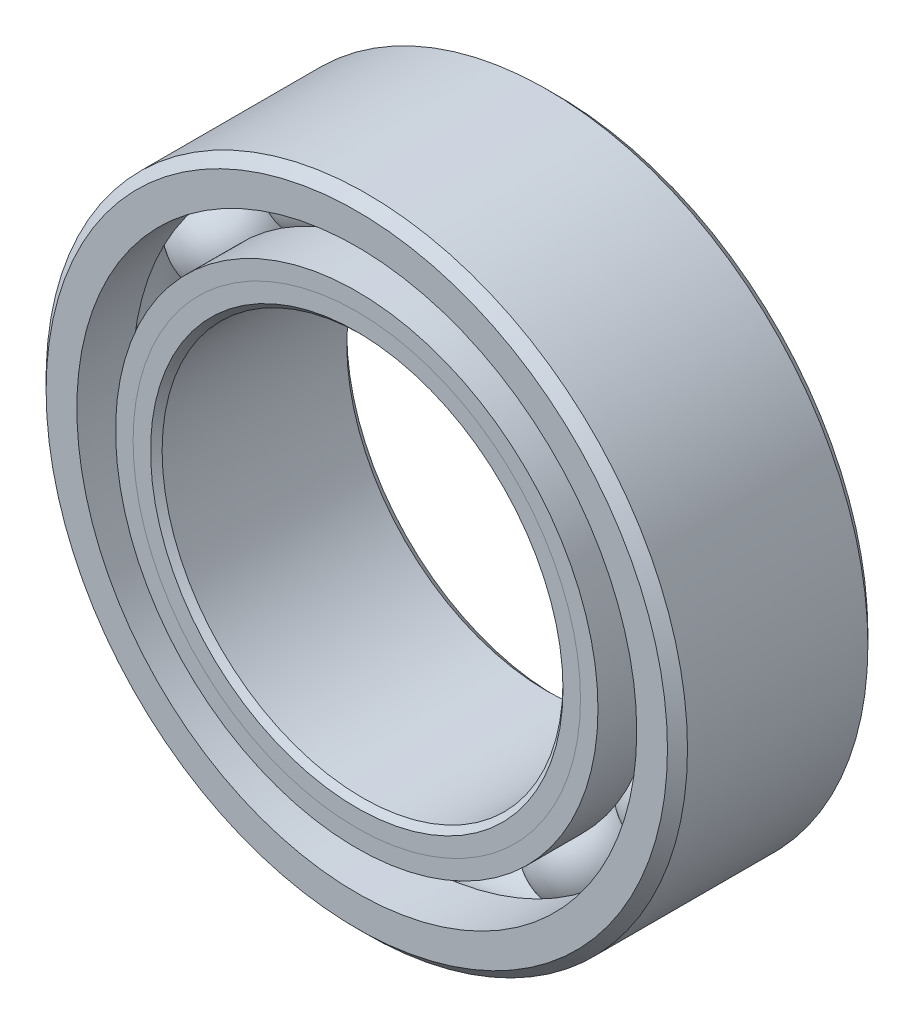
from build123d import *

# Parameters (mm, degrees)
CIRPATTERN1_COUNT = 12


with BuildPart() as part:
    # Sketch1 → Revolve1 (revolve)
    with BuildSketch(Plane(origin=(0, 0, 0), x_dir=(0, 0, -1), z_dir=(1, 0, 0)), mode=Mode.PRIVATE) as revolve1_sk:
        with BuildLine():
            Line((1.7859375, 6.35), (-1.7859375, 6.35))
            Line((-1.7859375, 6.35), (-1.984375, 6.1515625))
            Line((-1.984375, 6.1515625), (-1.984375, 5.543166209))
            Line((-1.984375, 5.543166209), (-0.881944444, 5.543166209))
            ThreePointArc((-0.881944444, 5.543166209), (0, 6.121207467), (0.881944444, 5.543166209))
            Line((0.881944444, 5.543166209), (1.984375, 5.543166209))
            Line((1.984375, 5.543166209), (1.984375, 6.1515625))
            Line((1.984375, 6.1515625), (1.7859375, 6.35))
        make_face()
    revolve(revolve1_sk.sketch.rotate(Axis((0, 0, 1.984375), (0, 0, -1)), 90), axis=Axis((0, 0, 1.984375), (0, 0, -1)))


with BuildPart() as body_2:
    # Sketch2 → Revolve2 (revolve)
    with BuildSketch(Plane(origin=(0, 0, 0), x_dir=(0, 0, -1), z_dir=(1, 0, 0)), mode=Mode.PRIVATE) as revolve2_sk:
        with BuildLine():
            Line((-1.984375, 4.775583791), (-0.881944444, 4.775583791))
            ThreePointArc((-0.881944444, 4.775583791), (-0.527247025, 4.354929682), (0, 4.197542533))
            Line((0, 4.197542533), (0, 4.083146266))
            Line((0, 4.083146266), (-1.638156238, 4.083146266))
            Line((-1.638156238, 4.083146266), (-1.984375, 4.429365029))
            Line((-1.984375, 4.429365029), (-1.984375, 4.775583791))
        make_face()
    revolve(revolve2_sk.sketch.rotate(Axis((0, 0, 1.984375), (0, 0, -1)), 90), axis=Axis((0, 0, 1.984375), (0, 0, -1)))


with BuildPart() as body_3:
    # Sketch3 → Revolve3 (revolve)
    with BuildSketch(Plane(origin=(0, 0, 0), x_dir=(0, 0, -1), z_dir=(1, 0, 0)), mode=Mode.PRIVATE) as revolve3_sk:
        with BuildLine():
            Line((-1.984375, 4.429365029), (-1.638156238, 4.083146266))
            Line((-1.638156238, 4.083146266), (0, 4.083146266))
            Line((0, 4.083146266), (0, 4.197542533))
            ThreePointArc((0, 4.197542533), (0.527247025, 4.354929682), (0.881944444, 4.775583791))
            Line((0.881944444, 4.775583791), (1.984375, 4.775583791))
            Line((1.984375, 4.775583791), (1.984375, 4.1671875))
            Line((1.984375, 4.1671875), (1.7859375, 3.96875))
            Line((1.7859375, 3.96875), (-1.869978734, 3.96875))
            Line((-1.869978734, 3.96875), (-1.984375, 4.083146266))
            Line((-1.984375, 4.083146266), (-1.984375, 4.429365029))
        make_face()
    revolve(revolve3_sk.sketch.rotate(Axis((0, 0, 1.984375), (0, 0, -1)), 90), axis=Axis((0, 0, 1.984375), (0, 0, -1)))


with BuildPart() as body_4:
    # Sketch4 → Revolve4 (revolve)
    with BuildSketch(Plane(origin=(0, 0, 0), x_dir=(0, 0, -1), z_dir=(1, 0, 0))):
        with BuildLine():
            Line((-0.961832467, 5.159375), (0.961832467, 5.159375))
            ThreePointArc((0.961832467, 5.159375), (0, 6.121207467), (-0.961832467, 5.159375))
        make_face()
    revolve(axis=Axis((0, 5.159375, 0.961832467), (0, 0, -1)))


with BuildPart() as cirpattern1_1:
    # CirPattern1: pattern copy
    add(body_4.part.rotate(Axis((0, 0, 0), (0, 0, 1)), 1 * 360 / CIRPATTERN1_COUNT))


with BuildPart() as cirpattern1_2:
    # CirPattern1: pattern copy
    add(body_4.part.rotate(Axis((0, 0, 0), (0, 0, 1)), 2 * 360 / CIRPATTERN1_COUNT))


with BuildPart() as cirpattern1_3:
    # CirPattern1: pattern copy
    add(body_4.part.rotate(Axis((0, 0, 0), (0, 0, 1)), 3 * 360 / CIRPATTERN1_COUNT))


with BuildPart() as cirpattern1_4:
    # CirPattern1: pattern copy
    add(body_4.part.rotate(Axis((0, 0, 0), (0, 0, 1)), 4 * 360 / CIRPATTERN1_COUNT))


with BuildPart() as cirpattern1_5:
    # CirPattern1: pattern copy
    add(body_4.part.rotate(Axis((0, 0, 0), (0, 0, 1)), 5 * 360 / CIRPATTERN1_COUNT))


with BuildPart() as cirpattern1_6:
    # CirPattern1: pattern copy
    add(body_4.part.rotate(Axis((0, 0, 0), (0, 0, 1)), 6 * 360 / CIRPATTERN1_COUNT))


with BuildPart() as cirpattern1_7:
    # CirPattern1: pattern copy
    add(body_4.part.rotate(Axis((0, 0, 0), (0, 0, 1)), 7 * 360 / CIRPATTERN1_COUNT))


with BuildPart() as cirpattern1_8:
    # CirPattern1: pattern copy
    add(body_4.part.rotate(Axis((0, 0, 0), (0, 0, 1)), 8 * 360 / CIRPATTERN1_COUNT))


with BuildPart() as cirpattern1_9:
    # CirPattern1: pattern copy
    add(body_4.part.rotate(Axis((0, 0, 0), (0, 0, 1)), 9 * 360 / CIRPATTERN1_COUNT))


with BuildPart() as cirpattern1_10:
    # CirPattern1: pattern copy
    add(body_4.part.rotate(Axis((0, 0, 0), (0, 0, 1)), 10 * 360 / CIRPATTERN1_COUNT))


with BuildPart() as cirpattern1_11:
    # CirPattern1: pattern copy
    add(body_4.part.rotate(Axis((0, 0, 0), (0, 0, 1)), 11 * 360 / CIRPATTERN1_COUNT))


solid = Compound([part.part, body_2.part, body_3.part, body_4.part, cirpattern1_1.part, cirpattern1_2.part, cirpattern1_3.part, cirpattern1_4.part, cirpattern1_5.part, cirpattern1_6.part, cirpattern1_7.part, cirpattern1_8.part, cirpattern1_9.part, cirpattern1_10.part, cirpattern1_11.part])
